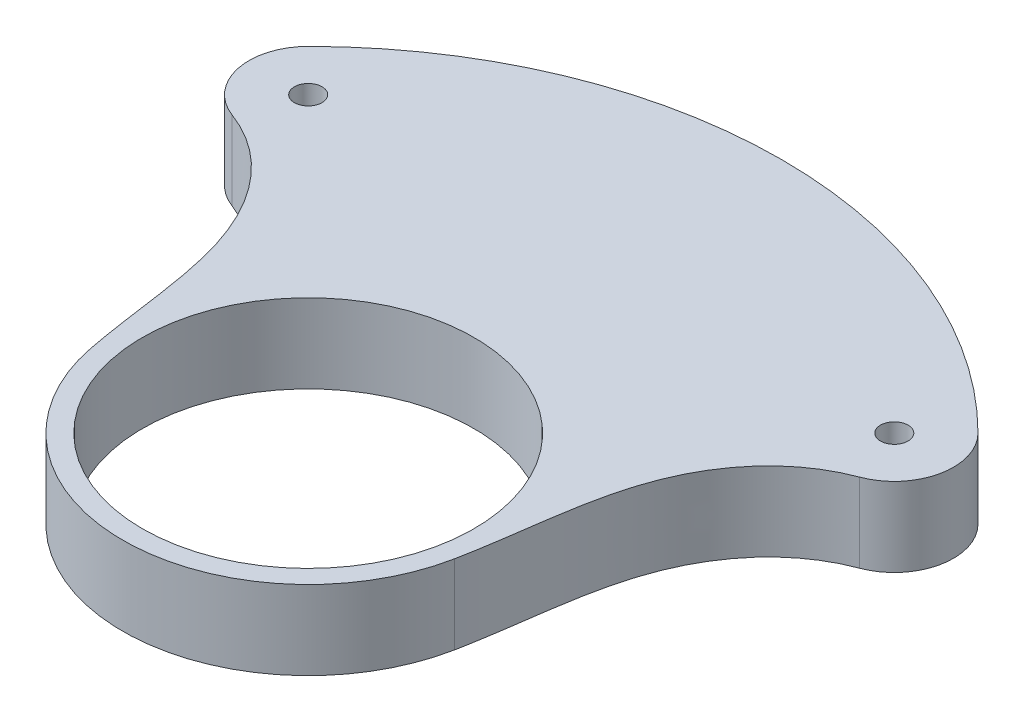
from build123d import *

# Parameters (mm, degrees)
SKETCH2_R           = 21
BOSS_EXTRUDE1_DEPTH = 10
CUT_EXTRUDE1_REACH  = 77.44
SKETCH3_R           = 1.75


with BuildPart() as part:
    # Sketch2 → Boss-Extrude1 (new body)
    # profile 1 of 6: a face of its own
    with BuildSketch(Plane(origin=(0, 0, 0), x_dir=(1, 0, 0), z_dir=(0, 1, 0))):
        with BuildLine():
            ThreePointArc((-39.742001703, 30.095205518), (-35.527778851, 29.794741171), (-31.819805153, 31.819805153))
            Line((-31.819805153, 31.819805153), (-42.426406871, 42.426406871))
            ThreePointArc((-42.426406871, 42.426406871), (-44.451470854, 35.527778851), (-39.742001703, 30.095205518))
        make_face()
    # profile 2 of 6: a face of its own
    with BuildSketch(Plane(origin=(0, 0, 0), x_dir=(1, 0, 0), z_dir=(0, 1, 0))):
        with BuildLine():
            Line((-42.426406871, 42.426406871), (-31.819805153, 31.819805153))
            ThreePointArc((-31.819805153, 31.819805153), (0, 45), (31.819805153, 31.819805153))
            ThreePointArc((31.819805153, 31.819805153), (35.527778851, 29.794741171), (39.742001703, 30.095205518))
            ThreePointArc((39.742001703, 30.095205518), (44.451470854, 35.527778851), (42.426406871, 42.426406871))
            ThreePointArc((42.426406871, 42.426406871), (0, 60), (-42.426406871, 42.426406871))
        make_face()
    # profile 3 of 6: a face of its own
    with BuildSketch(Plane(origin=(0, 0, 0), x_dir=(1, 0, 0), z_dir=(0, 1, 0))):
        with BuildLine():
            ThreePointArc((31.819805153, 31.819805153), (0, 45), (-31.819805153, 31.819805153))
            ThreePointArc((-31.819805153, 31.819805153), (-33.665365801, 29.860394262), (-35.390472848, 27.794143836))
            add(Edge.make_bspline(
                [(-35.390472848, 27.794143836), (-32.245912853, 25.570807212), (-24.806129807, 15.839794796), (-24.750821328, 4.074395815), (-23.058627279, -4.533178579)],
                knots=[0.115209689, 0.115209689, 0.115209689, 0.115209689, 0.392292763, 1, 1, 1, 1], degree=3))
            ThreePointArc((-23.058627279, -4.533178579), (-2.277307506, 23.38939654), (23.5, 0))
            ThreePointArc((23.5, 0), (23.38939654, -2.277307506), (23.058627279, -4.533178579))
            add(Edge.make_bspline(
                [(35.390472848, 27.794143836), (32.245912853, 25.570807212), (24.806129807, 15.839794796), (24.750821328, 4.074395815), (23.058627279, -4.533178579)],
                knots=[0.115209689, 0.115209689, 0.115209689, 0.115209689, 0.392292763, 1, 1, 1, 1], degree=3))
            ThreePointArc((35.390472848, 27.794143836), (33.665365801, 29.860394262), (31.819805153, 31.819805153))
        make_face()
    # profile 4 of 6: a face of its own
    with BuildSketch(Plane(origin=(0, 0, 0), x_dir=(1, 0, 0), z_dir=(0, 1, 0))):
        with BuildLine():
            ThreePointArc((-35.390472848, 27.794143836), (-33.665365801, 29.860394262), (-31.819805153, 31.819805153))
            ThreePointArc((-31.819805153, 31.819805153), (-35.527778851, 29.794741171), (-39.742001703, 30.095205518))
            add(Edge.make_bspline(
                [(-39.742001703, 30.095205518), (-38.146305527, 29.500581015), (-36.697964408, 28.718595549), (-35.390472848, 27.794143836)],
                knots=[0, 0, 0, 0, 0.115209689, 0.115209689, 0.115209689, 0.115209689], degree=3))
        make_face()
    # profile 5 of 6: a face of its own
    with BuildSketch(Plane(origin=(0, 0, 0), x_dir=(1, 0, 0), z_dir=(0, 1, 0))):
        with BuildLine():
            ThreePointArc((39.742001703, 30.095205518), (35.527778851, 29.794741171), (31.819805153, 31.819805153))
            ThreePointArc((31.819805153, 31.819805153), (33.665365801, 29.860394262), (35.390472848, 27.794143836))
            add(Edge.make_bspline(
                [(39.742001703, 30.095205518), (38.146305527, 29.500581015), (36.697964408, 28.718595549), (35.390472848, 27.794143836)],
                knots=[0, 0, 0, 0, 0.115209689, 0.115209689, 0.115209689, 0.115209689], degree=3))
        make_face()
    # profile 6 of 6: a face of its own
    with BuildSketch(Plane(origin=(0, 0, 0), x_dir=(1, 0, 0), z_dir=(0, 1, 0))):
        with BuildLine():
            ThreePointArc((23.5, 0), (-2.277307506, 23.38939654), (-23.058627279, -4.533178579))
            ThreePointArc((-23.058627279, -4.533178579), (0, -23.5), (23.058627279, -4.533178579))
            ThreePointArc((23.058627279, -4.533178579), (23.38939654, -2.277307506), (23.5, 0))
        make_face()
        with Locations(Location((0, 0, 0), (0, 0, 270))):
            Circle(SKETCH2_R, mode=Mode.SUBTRACT)
    extrude(amount=BOSS_EXTRUDE1_DEPTH)

    # Sketch3 → Cut-Extrude1 (cut, up to next)
    with BuildSketch(Plane(origin=(0, 10, 0), x_dir=(1, 0, 0), z_dir=(0, 1, 0)), mode=Mode.PRIVATE) as cut_extrude1_sk1:
        with Locations(Location((-37.123106012, 37.123106012, 0), (0, 0, 270))):
            Circle(SKETCH3_R)
    cut_extrude1_tool1 = extrude(cut_extrude1_sk1.sketch, amount=-CUT_EXTRUDE1_REACH, mode=Mode.PRIVATE) & part.part
    # Sketch3 → Cut-Extrude1 (cut, up to next)
    with BuildSketch(Plane(origin=(0, 10, 0), x_dir=(1, 0, 0), z_dir=(0, 1, 0)), mode=Mode.PRIVATE) as cut_extrude1_sk2:
        with Locations(Location((37.123106012, 37.123106012, 0), (0, 0, 270))):
            Circle(SKETCH3_R)
    cut_extrude1_tool2 = extrude(cut_extrude1_sk2.sketch, amount=-CUT_EXTRUDE1_REACH, mode=Mode.PRIVATE) & part.part
    add(cut_extrude1_tool1.solids().sort_by_distance((-37.123106, 10, -37.123106))[0], mode=Mode.SUBTRACT)
    add(cut_extrude1_tool2.solids().sort_by_distance((37.123106, 10, -37.123106))[0], mode=Mode.SUBTRACT)


solid = part.part
